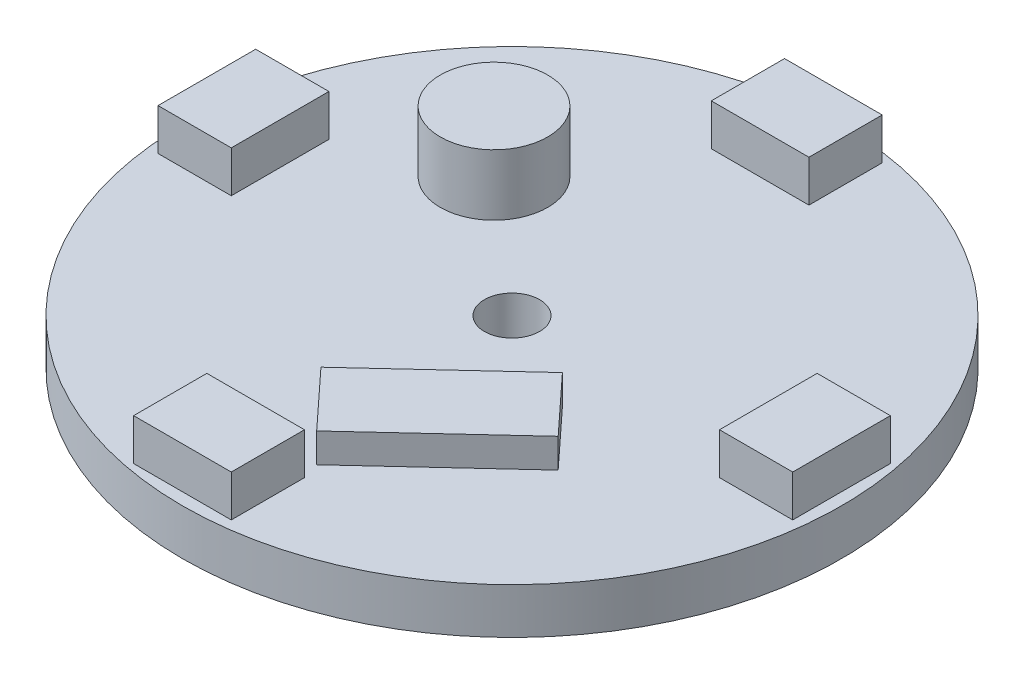
from build123d import *

# Parameters (mm, degrees)
SKETCH1_R           = 17.145
SKETCH1_R_2         = 1.436229084
BOSS_EXTRUDE1_DEPTH = 2.38125
SKETCH3_R           = 2.794
BOSS_EXTRUDE2_DEPTH = 3.175
BOSS_EXTRUDE3_DEPTH = 1.524
SKETCH5_W           = 5.08
SKETCH5_H           = 3.81
SKETCH5_W_2         = 3.81
SKETCH5_H_2         = 5.08
BOSS_EXTRUDE4_DEPTH = 2.159


with BuildPart() as part:
    # Sketch1 → Boss-Extrude1 (new body)
    with BuildSketch(Plane(origin=(0, 0, 0), x_dir=(1, 0, 0), z_dir=(0, 1, 0))):
        with Locations(Location((-9.270876778, 8.817912865, 0), (0, 0, 90))):
            Circle(SKETCH1_R)
        with Locations(Location((-9.270876778, 8.817912865, 0), (0, 0, 90))):
            Circle(SKETCH1_R_2, mode=Mode.SUBTRACT)
    extrude(amount=BOSS_EXTRUDE1_DEPTH)

    # Sketch3 → Boss-Extrude2 (add)
    with BuildSketch(Plane(origin=(0, 2.38125, 0), x_dir=(1, 0, 0), z_dir=(0, 1, 0))):
        with Locations(Location((-16.007627964, 14.618626912, 0), (0, 0, 270))):
            Circle(SKETCH3_R)
    extrude(amount=BOSS_EXTRUDE2_DEPTH)

    # Sketch4 → Boss-Extrude3 (add)
    with BuildSketch(Plane(origin=(0, 2.38125, 0), x_dir=(1, 0, 0), z_dir=(0, 1, 0))):
        Polygon((-10.391608677, -0.001160783), (-3.867194412, 6.037391899), (-1.106713185, 3.054802521), (-7.63112745, -2.983750162), (-10.046548523, -0.373984456), align=None)
    extrude(amount=BOSS_EXTRUDE3_DEPTH)

    # Sketch5 → Boss-Extrude4 (add)
    with BuildSketch(Plane(origin=(0, 2.38125, 0), x_dir=(1, 0, 0), z_dir=(0, 1, 0))):
        with Locations((-9.905876778, -5.787087135)):
            Rectangle(SKETCH5_W, SKETCH5_H)
        with Locations((-9.062799481, 23.422912865)):
            Rectangle(SKETCH5_W, SKETCH5_H)
        with Locations((-23.875876778, 9.452912865)):
            Rectangle(SKETCH5_W_2, SKETCH5_H_2)
        with Locations((5.334123222, 9.452912865)):
            Rectangle(SKETCH5_W_2, SKETCH5_H_2)
    extrude(amount=BOSS_EXTRUDE4_DEPTH)


solid = part.part
